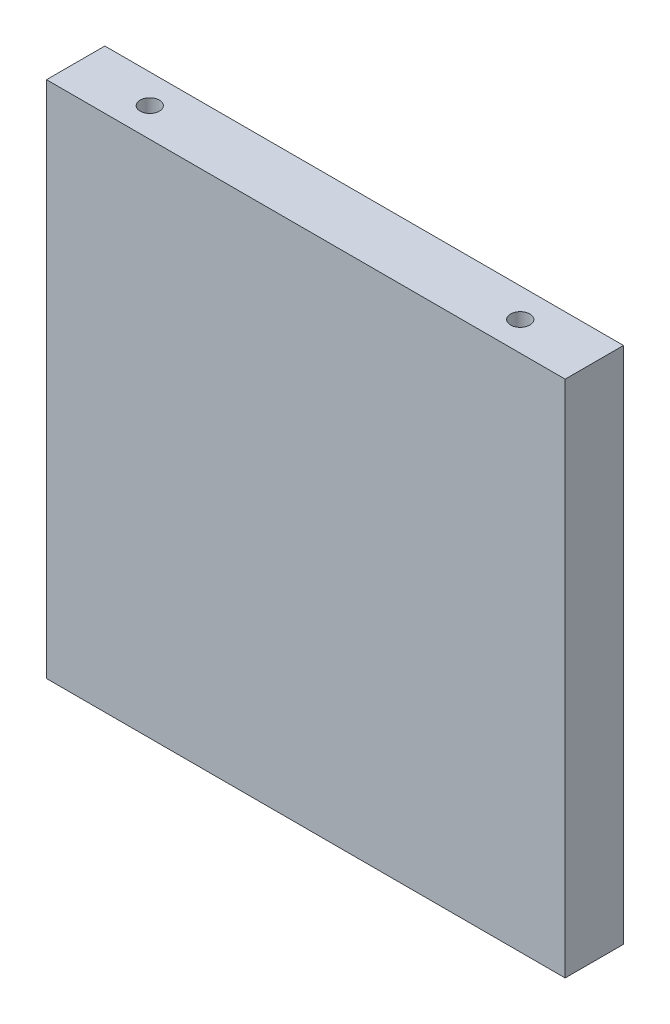
from build123d import *

# Parameters (mm, degrees)
SKETCH1_W           = 88.9
SKETCH1_H           = 10
SKETCH1_R           = 1.65
BOSS_EXTRUDE1_DEPTH = 88.9


with BuildPart() as part:
    # Sketch1 → Boss-Extrude1 (new body)
    with BuildSketch(Plane(origin=(0, 0, 0), x_dir=(1, 0, 0), z_dir=(0, 1, 0))):
        with Locations((44.45, 5)):
            Rectangle(SKETCH1_W, SKETCH1_H)
        with Locations(Location((12.7, 5, 0), (0, 0, 270))):
            Circle(SKETCH1_R, mode=Mode.SUBTRACT)
        with Locations(Location((76.2, 5, 0), (0, 0, 270))):
            Circle(SKETCH1_R, mode=Mode.SUBTRACT)
    extrude(amount=BOSS_EXTRUDE1_DEPTH)


solid = part.part
